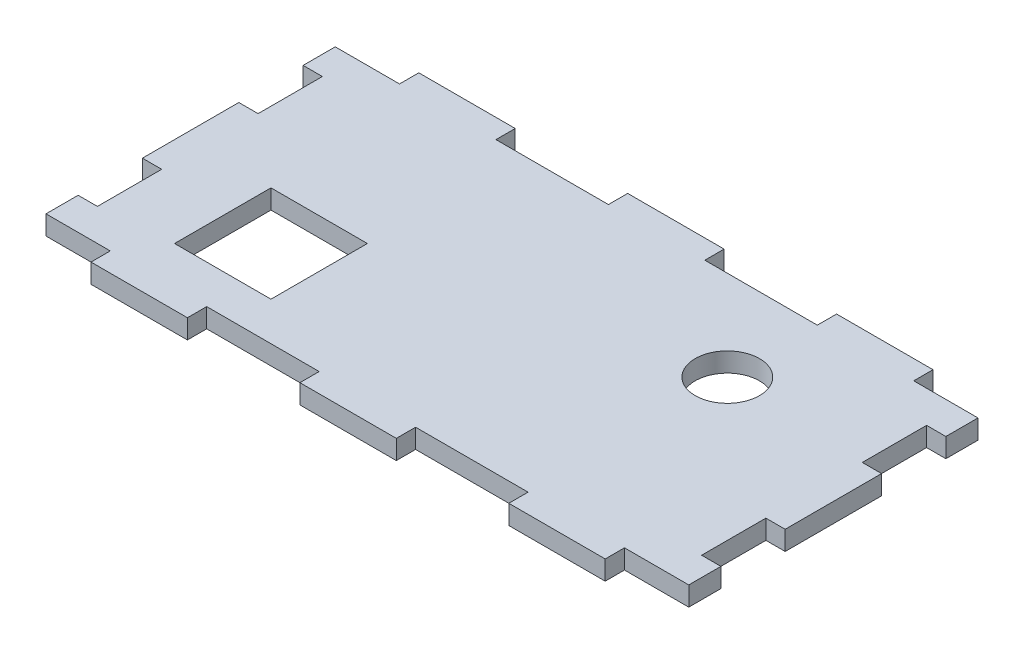
from build123d import *

# Parameters (mm, degrees)
EXTRUDE_1_DEPTH     = 3
SKETCH_2_R          = 5
SKETCH_2_W          = 15
SKETCH_2_H          = 15
CUT_EXTRUDE_1_DEPTH = 57.207205944


with BuildPart() as part:
    # 草图1 → 凸台-拉伸1 (new body)
    with BuildSketch(Plane(origin=(0, 0, 0), x_dir=(1, 0, 0), z_dir=(0, 1, 0))):
        Polygon((-50, -22.5), (-40, -22.5), (-40, -25.5), (-25, -25.5), (-25, -22.5), (-7.5, -22.5), (-7.5, -25.5), (7.5, -25.5), (7.5, -22.5), (25, -22.5), (25, -25.5), (40, -25.5), (40, -22.5), (50, -22.5), (50, -17.5), (47, -17.5), (47, -7.5), (50, -7.5), (50, 7.5), (47, 7.5), (47, 17.5), (50, 17.5), (50, 22.5), (40, 22.5), (40, 25.5), (25, 25.5), (25, 22.5), (7.5, 22.5), (7.5, 25.5), (-7.5, 25.5), (-7.5, 22.5), (-25, 22.5), (-25, 25.5), (-40, 25.5), (-40, 22.5), (-50, 22.5), (-50, 17.5), (-47, 17.5), (-47, 7.5), (-50, 7.5), (-50, -7.5), (-47, -7.5), (-47, -17.5), (-50, -17.5), align=None)
    extrude(amount=EXTRUDE_1_DEPTH)

    # 草图2 → 切除-拉伸1 (cut, through all)
    with BuildSketch(Plane(origin=(0, 3, 0), x_dir=(1, 0, 0), z_dir=(0, 1, 0))):
        with Locations(Location((25, 8.5, 0), (0, 0, 270))):
            Circle(SKETCH_2_R)
        with Locations((-28.5, -9)):
            Rectangle(SKETCH_2_W, SKETCH_2_H)
    extrude(amount=-CUT_EXTRUDE_1_DEPTH, mode=Mode.SUBTRACT)


solid = part.part
